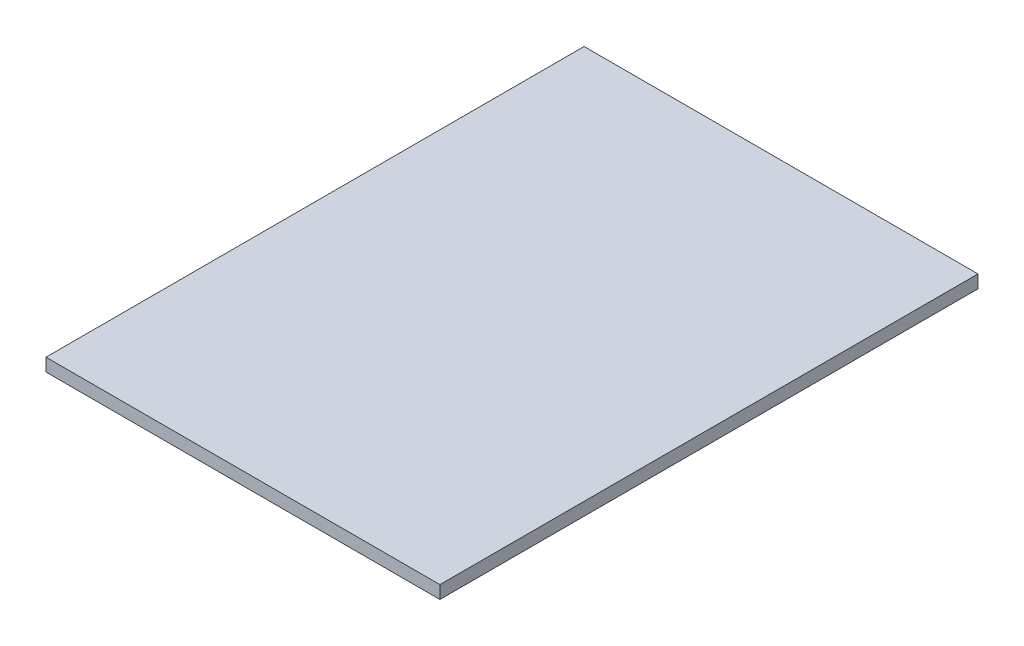
from build123d import *

# Parameters (mm, degrees)
SKETCH2_W           = 122.1
SKETCH2_H           = 192.8
BOSS_EXTRUDE3_DEPTH = 4
SKETCH3_W           = 122.1
SKETCH3_H           = 4
BOSS_EXTRUDE4_DEPTH = 5
SKETCH4_W           = 213.977787157
SKETCH4_H           = 137.124862953
CUT_EXTRUDE1_DEPTH  = 12
SKETCH5_W           = 196.372741807
SKETCH5_H           = 135.766117788
CUT_EXTRUDE2_DEPTH  = 19


with BuildPart() as part:
    # Sketch2 → Boss-Extrude3 (new body)
    with BuildSketch(Plane(origin=(0, 0, 0), x_dir=(1, 0, 0), z_dir=(0, 1, 0))):
        with Locations((61.05, 96.4)):
            Rectangle(SKETCH2_W, SKETCH2_H)
    extrude(amount=BOSS_EXTRUDE3_DEPTH)

    # Sketch3 → Boss-Extrude4 (add)
    with BuildSketch(Plane(origin=(0, 0, -192.8), x_dir=(-1, 0, 0), z_dir=(0, 0, -1))):
        with Locations((-61.05, 2)):
            Rectangle(SKETCH3_W, SKETCH3_H)
    extrude(amount=BOSS_EXTRUDE4_DEPTH)

    # Sketch4 → Cut-Extrude1 (cut)
    with BuildSketch(Plane(origin=(0, 0, -197.8), x_dir=(-1, 0, 0), z_dir=(0, 0, -1))):
        with Locations((-77.102367238, 6.310456311)):
            Rectangle(SKETCH4_W, SKETCH4_H)
    extrude(amount=-CUT_EXTRUDE1_DEPTH, mode=Mode.SUBTRACT)

    # Sketch5 → Cut-Extrude2 (cut)
    with BuildSketch(Plane.XY):
        with Locations((63.791953285, 8.689014337)):
            Rectangle(SKETCH5_W, SKETCH5_H)
    extrude(amount=-CUT_EXTRUDE2_DEPTH, mode=Mode.SUBTRACT)


solid = part.part
